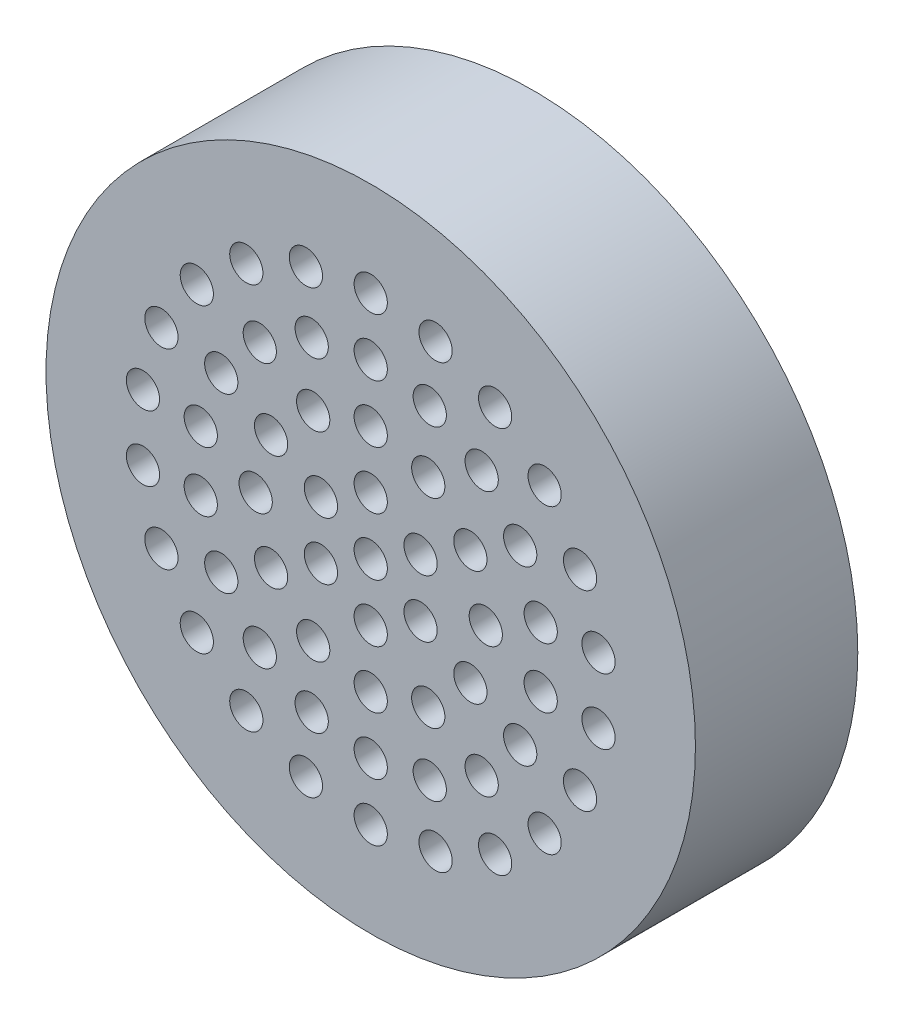
from build123d import *

# Parameters (mm, degrees)
ESQUISSE1_R             = 25.4
BOSS_EXTRU_1_DEPTH      = 12.7
ESQUISSE2_R             = 1.3
ENL_V_MAT_EXTRU_1_DEPTH = 12.7


with BuildPart() as part:
    # Esquisse1 → Boss.-Extru.1 (new body)
    with BuildSketch(Plane.XY):
        Circle(ESQUISSE1_R)
    extrude(amount=BOSS_EXTRU_1_DEPTH)

    # Esquisse2 → Enlèv. mat.-Extru.1 (cut)
    with BuildSketch(Plane(origin=(0, 0, 0), x_dir=(-1, 0, 0), z_dir=(0, 0, -1))):
        Circle(ESQUISSE2_R)
        with Locations((0, 4.5)):
            Circle(ESQUISSE2_R)
        with Locations((0, 9)):
            Circle(ESQUISSE2_R)
        with Locations((0, 13.5)):
            Circle(ESQUISSE2_R)
        with Locations((0, 18)):
            Circle(ESQUISSE2_R)
        with Locations((3.897114317, 2.25)):
            Circle(ESQUISSE2_R)
        with Locations((3.897114317, -2.25)):
            Circle(ESQUISSE2_R)
        with Locations((0, -4.5)):
            Circle(ESQUISSE2_R)
        with Locations((-3.897114317, -2.25)):
            Circle(ESQUISSE2_R)
        with Locations((-3.897114317, 2.25)):
            Circle(ESQUISSE2_R)
        with Locations((4.5, 7.794228634)):
            Circle(ESQUISSE2_R)
        with Locations((7.794228634, 4.5)):
            Circle(ESQUISSE2_R)
        with Locations((9, 0)):
            Circle(ESQUISSE2_R)
        with Locations((7.794228634, -4.5)):
            Circle(ESQUISSE2_R)
        with Locations((4.5, -7.794228634)):
            Circle(ESQUISSE2_R)
        with Locations((0, -9)):
            Circle(ESQUISSE2_R)
        with Locations((-4.5, -7.794228634)):
            Circle(ESQUISSE2_R)
        with Locations((-7.794228634, -4.5)):
            Circle(ESQUISSE2_R)
        with Locations((-9, 0)):
            Circle(ESQUISSE2_R)
        with Locations((-7.794228634, 4.5)):
            Circle(ESQUISSE2_R)
        with Locations((-4.5, 7.794228634)):
            Circle(ESQUISSE2_R)
        with Locations((4.617271935, 12.685850381)):
            Circle(ESQUISSE2_R)
        with Locations((8.677632731, 10.341599982)):
            Circle(ESQUISSE2_R)
        with Locations((11.691342951, 6.75)):
            Circle(ESQUISSE2_R)
        with Locations((13.294904666, 2.344250399)):
            Circle(ESQUISSE2_R)
        with Locations((13.294904666, -2.344250399)):
            Circle(ESQUISSE2_R)
        with Locations((11.691342951, -6.75)):
            Circle(ESQUISSE2_R)
        with Locations((8.677632731, -10.341599982)):
            Circle(ESQUISSE2_R)
        with Locations((4.617271935, -12.685850381)):
            Circle(ESQUISSE2_R)
        with Locations((0, -13.5)):
            Circle(ESQUISSE2_R)
        with Locations((-4.617271935, -12.685850381)):
            Circle(ESQUISSE2_R)
        with Locations((-8.677632731, -10.341599982)):
            Circle(ESQUISSE2_R)
        with Locations((-11.691342951, -6.75)):
            Circle(ESQUISSE2_R)
        with Locations((-13.294904666, -2.344250399)):
            Circle(ESQUISSE2_R)
        with Locations((-13.294904666, 2.344250399)):
            Circle(ESQUISSE2_R)
        with Locations((-11.691342951, 6.75)):
            Circle(ESQUISSE2_R)
        with Locations((-8.677632731, 10.341599982)):
            Circle(ESQUISSE2_R)
        with Locations((-4.617271935, 12.685850381)):
            Circle(ESQUISSE2_R)
        with Locations((5.071186023, 17.270873525)):
            Circle(ESQUISSE2_R)
        with Locations((9.731534714, 15.142563591)):
            Circle(ESQUISSE2_R)
        with Locations((13.603492338, 11.787493211)):
            Circle(ESQUISSE2_R)
        with Locations((16.373375916, 7.477470234)):
            Circle(ESQUISSE2_R)
        with Locations((17.816785954, 2.561667089)):
            Circle(ESQUISSE2_R)
        with Locations((17.816785954, -2.561667089)):
            Circle(ESQUISSE2_R)
        with Locations((16.373375916, -7.477470234)):
            Circle(ESQUISSE2_R)
        with Locations((13.603492338, -11.787493211)):
            Circle(ESQUISSE2_R)
        with Locations((9.731534714, -15.142563591)):
            Circle(ESQUISSE2_R)
        with Locations((5.071186023, -17.270873525)):
            Circle(ESQUISSE2_R)
        with Locations((0, -18)):
            Circle(ESQUISSE2_R)
        with Locations((-5.071186023, -17.270873525)):
            Circle(ESQUISSE2_R)
        with Locations((-9.731534714, -15.142563591)):
            Circle(ESQUISSE2_R)
        with Locations((-13.603492338, -11.787493211)):
            Circle(ESQUISSE2_R)
        with Locations((-16.373375916, -7.477470234)):
            Circle(ESQUISSE2_R)
        with Locations((-17.816785954, -2.561667089)):
            Circle(ESQUISSE2_R)
        with Locations((-17.816785954, 2.561667089)):
            Circle(ESQUISSE2_R)
        with Locations((-16.373375916, 7.477470234)):
            Circle(ESQUISSE2_R)
        with Locations((-13.603492338, 11.787493211)):
            Circle(ESQUISSE2_R)
        with Locations((-9.731534714, 15.142563591)):
            Circle(ESQUISSE2_R)
        with Locations((-5.071186023, 17.270873525)):
            Circle(ESQUISSE2_R)
    extrude(amount=-ENL_V_MAT_EXTRU_1_DEPTH, mode=Mode.SUBTRACT)


solid = part.part
